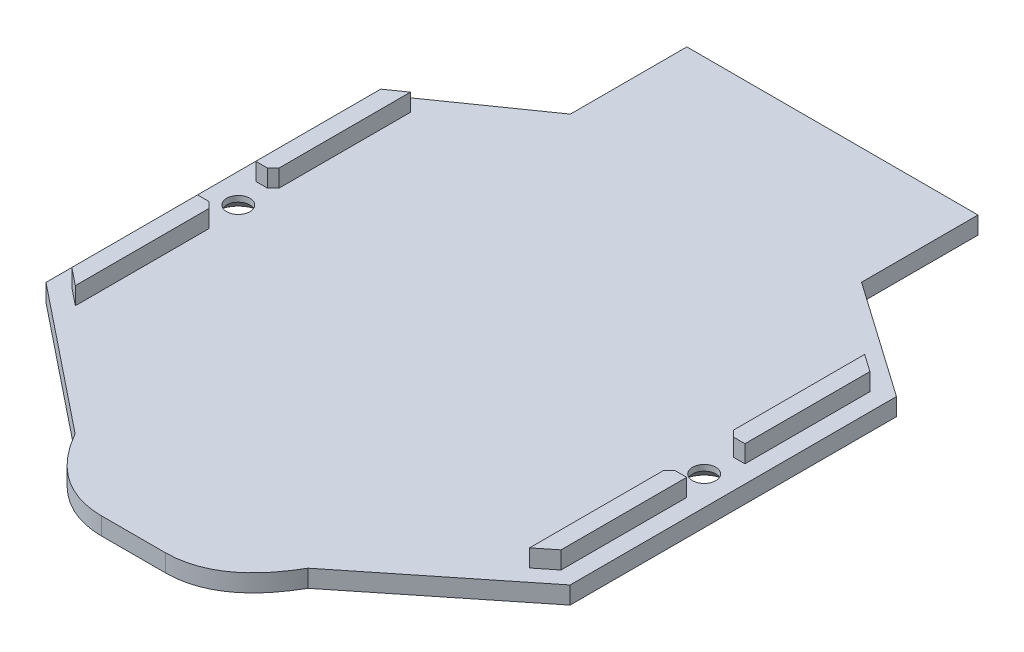
from build123d import *

# Parameters (mm, degrees)
BOSS_EXTRUDE1_DEPTH = 1.905
BOSS_EXTRUDE2_DEPTH = 3.81
SKETCH4_R           = 1.27
CUT_EXTRUDE1_DEPTH  = 3.81
CHAMFER1_SIZE       = 1.27
BOSS_EXTRUDE3_DEPTH = 1.905


with BuildPart() as part:
    # Sketch2 → Boss-Extrude1 (new body)
    with BuildSketch(Plane(origin=(0, 0, 0), x_dir=(1, 0, 0), z_dir=(0, 1, 0))):
        with BuildLine():
            Line((-15.52955712, 24.480722254), (-28.22955712, 15.590722254))
            Line((-28.22955712, 15.590722254), (-28.22955712, -19.997532082))
            Line((-28.22955712, -19.997532082), (-12.354557094, -32.697532128))
            add(Edge.make_bspline(
                [(-12.354557094, -32.697532128), (-10.357340532, -36.191853262), (-7.467085325, -39.002495951), (-3.133791164, -39.019277746)],
                knots=[0.450643599, 0.450643599, 0.450643599, 0.450643599, 1, 1, 1, 1], degree=3))
            Line((-3.133791164, -39.019277746), (3.824676923, -39.019277746))
            add(Edge.make_bspline(
                [(3.824676923, -39.019277746), (8.157971103, -39.002495951), (11.048226317, -36.191853237), (13.04544288, -32.697532082)],
                knots=[0.450643596, 0.450643596, 0.450643596, 0.450643596, 1, 1, 1, 1], degree=3))
            Line((13.04544288, -32.697532082), (28.92044288, -19.997532082))
            Line((28.92044288, -19.997532082), (28.92044288, 15.590722254))
            Line((28.92044288, 15.590722254), (16.22044288, 24.480722254))
            Line((16.22044288, 24.480722254), (16.22044288, 37.180722254))
            Line((16.22044288, 37.180722254), (-15.52955712, 37.180722254))
            Line((-15.52955712, 37.180722254), (-15.52955712, 24.480722254))
        make_face()
    extrude(amount=BOSS_EXTRUDE1_DEPTH)

    # Sketch3 → Boss-Extrude2 (add)
    with BuildSketch(Plane(origin=(0, 0, 0), x_dir=(1, 0, 0), z_dir=(0, 1, 0))):
        Polygon((-24.41955712, 1.606595086), (-24.41955712, 15.932373409), (-26.32455712, 14.598873409), (-26.32455712, 0.971595086), (-25.05455712, 0.971595086), align=None)
        Polygon((27.01544288, 14.598873409), (25.11044288, 15.932373409), (25.11044288, 1.606595086), (25.74544288, 0.971595086), (27.01544288, 0.971595086), align=None)
        Polygon((-24.41955712, -6.013404914), (-25.05455712, -5.378404914), (-26.32455712, -5.378404914), (-26.32455712, -19.081941748), (-24.41955712, -20.605941748), align=None)
        Polygon((27.01544288, -5.378404914), (25.74544288, -5.378404914), (25.11044288, -6.013404914), (25.11044288, -20.605941748), (27.01544288, -19.081941748), align=None)
    extrude(amount=BOSS_EXTRUDE2_DEPTH)

    # Sketch4 → Cut-Extrude1 (cut)
    with BuildSketch(Plane(origin=(0, 0, 0), x_dir=(1, 0, 0), z_dir=(0, 1, 0))):
        with Locations((-25.05455712, -2.203404914)):
            Circle(SKETCH4_R)
        with Locations((25.74544288, -2.203404914)):
            Circle(SKETCH4_R)
    extrude(amount=CUT_EXTRUDE1_DEPTH, mode=Mode.SUBTRACT)

    # Chamfer1
    chamfer1_edges = [part.edges().sort_by_distance(p)[0] for p in [
        (-26.32455712, 0, 2.203404914),
        (24.47544288, 0, 2.203404914),
    ]]
    chamfer(chamfer1_edges, length=CHAMFER1_SIZE)

    # Sketch5 → Boss-Extrude3 (add)
    with BuildSketch(Plane.XZ):
        with BuildLine():
            Line((-6.63955712, 26.9875), (7.33044288, 26.9875))
            ThreePointArc((7.33044288, 26.9875), (8.91794288, 25.4), (7.33044288, 23.8125))
            Line((7.33044288, 23.8125), (-6.63955712, 23.8125))
            ThreePointArc((-6.63955712, 23.8125), (-8.22705712, 25.4), (-6.63955712, 26.9875))
        make_face()
        with BuildLine():
            Line((-6.63955712, -28.8925), (7.33044288, -28.8925))
            ThreePointArc((7.33044288, -28.8925), (8.91794288, -30.48), (7.33044288, -32.0675))
            Line((7.33044288, -32.0675), (-6.63955712, -32.0675))
            ThreePointArc((-6.63955712, -32.0675), (-8.22705712, -30.48), (-6.63955712, -28.8925))
        make_face()
        with BuildLine():
            Line((-17.11705712, 17.111777746), (-17.11705712, 10.126777746))
            ThreePointArc((-17.11705712, 10.126777746), (-18.70455712, 8.539277746), (-20.29205712, 10.126777746))
            Line((-20.29205712, 10.126777746), (-20.29205712, 17.111777746))
            ThreePointArc((-20.29205712, 17.111777746), (-18.70455712, 18.699277746), (-17.11705712, 17.111777746))
        make_face()
        with BuildLine():
            Line((20.98294288, 17.111777746), (20.98294288, 10.126777746))
            ThreePointArc((20.98294288, 10.126777746), (19.39544288, 8.539277746), (17.80794288, 10.126777746))
            Line((17.80794288, 10.126777746), (17.80794288, 17.111777746))
            ThreePointArc((17.80794288, 17.111777746), (19.39544288, 18.699277746), (20.98294288, 17.111777746))
        make_face()
    extrude(amount=BOSS_EXTRUDE3_DEPTH)


solid = part.part
